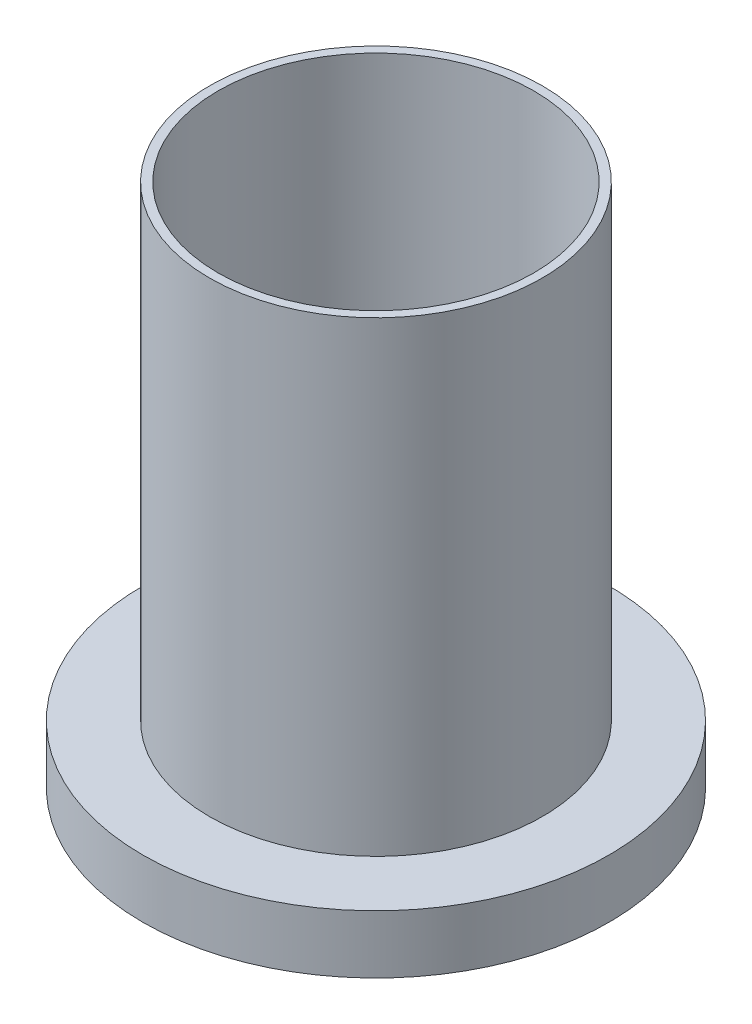
from build123d import *

# Parameters (mm, degrees)
SKETCH1_R           = 31.75
SKETCH1_R_2         = 30.099
BOSS_EXTRUDE1_DEPTH = 100.076
SKETCH1_4_R         = 44.45
SKETCH1_4_R_2       = 31.75
BOSS_EXTRUDE2_DEPTH = 11.1125


with BuildPart() as part:
    # Sketch1 → Boss-Extrude1 (new body)
    with BuildSketch(Plane(origin=(0, 0, 0), x_dir=(1, 0, 0), z_dir=(0, 1, 0))):
        Circle(SKETCH1_R)
        Circle(SKETCH1_R_2, mode=Mode.SUBTRACT)
    extrude(amount=BOSS_EXTRUDE1_DEPTH)

    # Sketch1<4> → Boss-Extrude2 (add)
    with BuildSketch(Plane(origin=(0, 0, 0), x_dir=(1, 0, 0), z_dir=(0, 1, 0))):
        Circle(SKETCH1_4_R)
        Circle(SKETCH1_4_R_2, mode=Mode.SUBTRACT)
    extrude(amount=BOSS_EXTRUDE2_DEPTH)


solid = part.part
